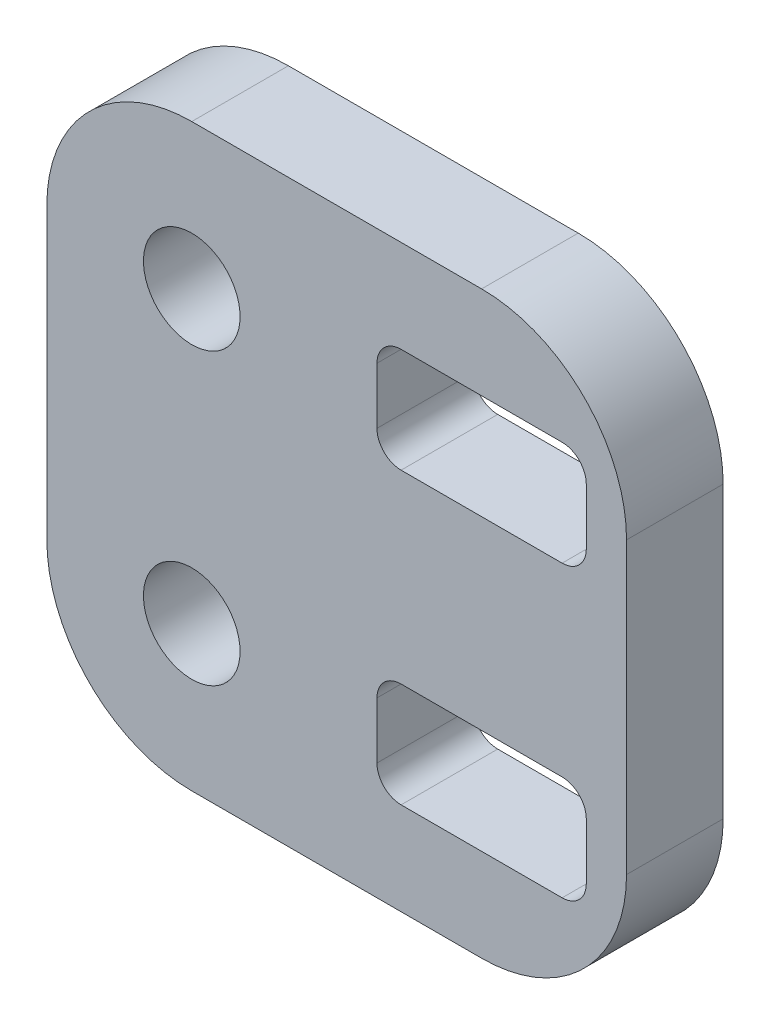
from build123d import *

# Parameters (mm, degrees)
MODEL_R                 = 1.5
SALIENTE_EXTRUIR1_DEPTH = 3


with BuildPart() as part:
    # Model → Saliente-Extruir1 (new body)
    with BuildSketch(Plane.XY):
        with BuildLine():
            Line((195.335922194, 161.333196305), (204.335922194, 161.333196305))
            ThreePointArc((204.335922194, 161.333196305), (207.517902709, 162.651215789), (208.835922194, 165.833196305))
            Line((208.835922194, 165.833196305), (208.835922194, 174.833196305))
            ThreePointArc((208.835922194, 174.833196305), (207.517902709, 178.01517682), (204.335922194, 179.333196305))
            Line((204.335922194, 179.333196305), (195.335922194, 179.333196305))
            ThreePointArc((195.335922194, 179.333196305), (192.153941678, 178.01517682), (190.835922194, 174.833196305))
            Line((190.835922194, 174.833196305), (190.835922194, 165.833196305))
            ThreePointArc((190.835922194, 165.833196305), (192.153941678, 162.651215789), (195.335922194, 161.333196305))
        make_face()
        with Locations((195.335922194, 174.833196305)):
            Circle(MODEL_R, mode=Mode.SUBTRACT)
        with Locations((195.335922194, 165.833196305)):
            Circle(MODEL_R, mode=Mode.SUBTRACT)
        with BuildLine():
            Line((206.835922194, 173.208196305), (201.835922194, 173.208196305))
            ThreePointArc((201.835922194, 173.208196305), (201.305592108, 173.427866219), (201.085922194, 173.958196305))
            Line((201.085922194, 173.958196305), (201.085922194, 175.708196305))
            ThreePointArc((201.085922194, 175.708196305), (201.305592108, 176.23852639), (201.835922194, 176.458196305))
            Line((201.835922194, 176.458196305), (206.835922194, 176.458196305))
            ThreePointArc((206.835922194, 176.458196305), (207.36625228, 176.23852639), (207.585922194, 175.708196305))
            Line((207.585922194, 175.708196305), (207.585922194, 173.958196305))
            ThreePointArc((207.585922194, 173.958196305), (207.36625228, 173.427866219), (206.835922194, 173.208196305))
        make_face(mode=Mode.SUBTRACT)
        with BuildLine():
            Line((206.835922194, 164.208196305), (201.835922194, 164.208196305))
            ThreePointArc((201.835922194, 164.208196305), (201.305592108, 164.427866219), (201.085922194, 164.958196305))
            Line((201.085922194, 164.958196305), (201.085922194, 166.708196305))
            ThreePointArc((201.085922194, 166.708196305), (201.305592108, 167.23852639), (201.835922194, 167.458196305))
            Line((201.835922194, 167.458196305), (206.835922194, 167.458196305))
            ThreePointArc((206.835922194, 167.458196305), (207.36625228, 167.23852639), (207.585922194, 166.708196305))
            Line((207.585922194, 166.708196305), (207.585922194, 164.958196305))
            ThreePointArc((207.585922194, 164.958196305), (207.36625228, 164.427866219), (206.835922194, 164.208196305))
        make_face(mode=Mode.SUBTRACT)
    extrude(amount=SALIENTE_EXTRUIR1_DEPTH)


solid = part.part
